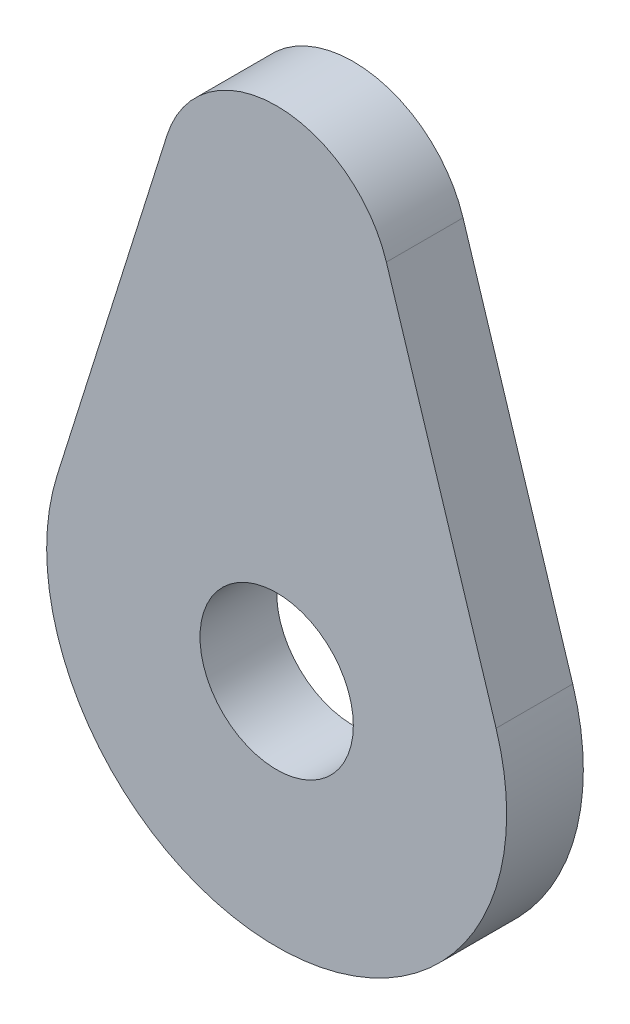
from build123d import *

# Parameters (mm, degrees)
SKETCH1_R           = 10
BOSS_EXTRUDE1_DEPTH = 5


with BuildPart() as part:
    # Sketch1 → Boss-Extrude1 (new, symmetric)
    with BuildSketch(Plane.XY):
        with BuildLine():
            Line((-14.309088021, 54.5), (-28.618176043, 9))
            ThreePointArc((-28.618176043, 9), (0, -30), (28.618176043, 9))
            Line((28.618176043, 9), (14.309088021, 54.5))
            ThreePointArc((14.309088021, 54.5), (0, 65), (-14.309088021, 54.5))
        make_face()
        Circle(SKETCH1_R, mode=Mode.SUBTRACT)
    extrude(amount=BOSS_EXTRUDE1_DEPTH, both=True)


solid = part.part
